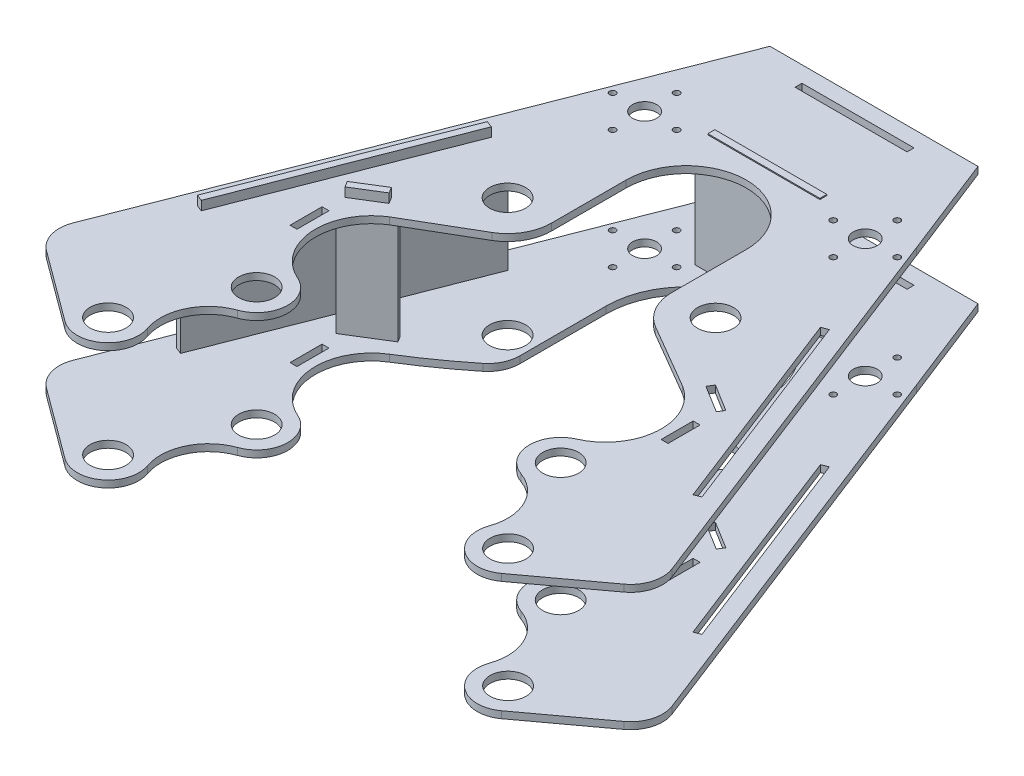
from build123d import *

# Parameters (mm, degrees)
CROQUIS13_R                   = 14.2875
CROQUIS13_R_2                 = 9.525
CROQUIS13_R_3                 = 2.4892
SALIENTE_EXTRUIR3_DEPTH       = 5.5
CROQUIS15_R                   = 14.2875
CROQUIS15_R_2                 = 2.4892
CROQUIS15_R_3                 = 9.525
SALIENTE_EXTRUIR4_DEPTH       = 5.5
REDONDEO3_R                   = 25.4
CORTAR_EXTRUIR5_DEPTH         = 415.249230424
CORTAR_EXTRUIR5_DEPTH_BACK    = 415.249230424
SALIENTE_EXTRUIR5_DEPTH       = 101.6
SALIENTE_EXTRUIR5_DEPTH_BACK  = 12.7
CROQUIS18_W                   = 5.5
CROQUIS18_H                   = 88.9
SALIENTE_EXTRUIR7_DEPTH       = 12.7
CROQUIS19_W                   = 5.5
CROQUIS19_H                   = 88.9
SALIENTE_EXTRUIR8_DEPTH       = 10.16
CORTAR_EXTRUIR7_DEPTH         = 416.949065279
CORTAR_EXTRUIR7_DEPTH_BACK    = 416.949065279
CROQUIS26_W                   = 88.9
CROQUIS26_H                   = 5.5
SALIENTE_EXTRUIR12_DEPTH      = 6.35
SALIENTE_EXTRUIR12_DEPTH_BACK = 101.6
CROQUIS27_W                   = 88.9
CROQUIS27_H                   = 5.5
CROQUIS28_W                   = 5.5
CROQUIS28_H                   = 88.9
SALIENTE_EXTRUIR13_DEPTH      = 10.16
CROQUIS29_W                   = 5.5
CROQUIS29_H                   = 88.9
SALIENTE_EXTRUIR14_DEPTH      = 10.16
CORTAR_EXTRUIR8_DEPTH         = 416.949065279
CORTAR_EXTRUIR8_DEPTH_BACK    = 416.949065279
CROQUIS41_W                   = 5.5
CROQUIS41_H                   = 25.4
SALIENTE_EXTRUIR15_DEPTH      = 12.7
SALIENTE_EXTRUIR15_DEPTH_BACK = 101.6
CROQUIS43_W                   = 5.5
CROQUIS43_H                   = 88.9
SALIENTE_EXTRUIR16_DEPTH      = 5.08
CROQUIS44_W                   = 5.5
CROQUIS44_H                   = 88.9
SALIENTE_EXTRUIR17_DEPTH      = 5.08


with BuildPart() as part:
    # Croquis13 → Saliente-Extruir3 (new body)
    with BuildSketch(Plane(origin=(0, 184.15, 0), x_dir=(1, 0, 0), z_dir=(0, 1, 0))):
        with BuildLine():
            Line((-47.753927487, -59.228856987), (-47.753927487, 0))
            ThreePointArc((-47.753927487, 0), (0, 47.753927487), (47.753927487, 0))
            Line((47.753927487, 0), (47.753927487, -59.228856987))
            ThreePointArc((47.753927487, -59.228856987), (52.378956655, -76.563066106), (65.024543628, -89.289213626))
            Line((65.024543628, -89.289213626), (116.36828917, -119.223075799))
            ThreePointArc((116.36828917, -119.223075799), (137.206577277, -160.143664069), (110.726633838, -197.660878664))
            ThreePointArc((110.726633838, -197.660878664), (95.963127804, -221.189322585), (112.411016209, -243.572703715))
            ThreePointArc((112.411016209, -243.572703715), (134.055970647, -263.012251323), (135.671142092, -292.060337061))
            ThreePointArc((135.671142092, -292.060337061), (144.229828611, -319.793855242), (173.253939317, -319.805828223))
            Line((173.253939317, -319.805828223), (229.133939317, -278.62361791))
            ThreePointArc((229.133939317, -278.62361791), (238.460514821, -265.248601277), (237.73344874, -248.959112167))
            Line((237.73344874, -248.959112167), (114.087344245, 68.540887833))
            Line((114.087344245, 68.540887833), (82.55, 149.070777022))
            Line((82.55, 149.070777022), (-82.55, 149.070777022))
            Line((-82.55, 149.070777022), (-114.087344245, 68.540887833))
            Line((-114.087344245, 68.540887833), (-237.73344874, -248.959112167))
            ThreePointArc((-237.73344874, -248.959112167), (-238.460514821, -265.248601277), (-229.133939317, -278.62361791))
            Line((-229.133939317, -278.62361791), (-173.253939317, -319.805828223))
            ThreePointArc((-173.253939317, -319.805828223), (-144.229828611, -319.793855242), (-135.671142092, -292.060337061))
            ThreePointArc((-135.671142092, -292.060337061), (-134.055970647, -263.012251323), (-112.411016209, -243.572703715))
            ThreePointArc((-112.411016209, -243.572703715), (-95.963127804, -221.189322585), (-110.726633838, -197.660878664))
            ThreePointArc((-110.726633838, -197.660878664), (-137.206577277, -160.143664069), (-116.36828917, -119.223075799))
            Line((-116.36828917, -119.223075799), (-65.024543628, -89.289213626))
            ThreePointArc((-65.024543628, -89.289213626), (-52.378956655, -76.563066106), (-47.753927487, -59.228856987))
        make_face()
        with Locations(Location((-120.65, -220.283627108, 0), (0, 0, 270))):
            Circle(CROQUIS13_R, mode=Mode.SUBTRACT)
        with Locations(Location((-82.55, -59.228856987, 0), (0, 0, 270))):
            Circle(CROQUIS13_R, mode=Mode.SUBTRACT)
        with Locations(Location((-87.546146377, 54.556438764, 0), (0, 0, 270))):
            Circle(CROQUIS13_R_2, mode=Mode.SUBTRACT)
        with Locations(Location((-87.546146377, 79.956438764, 0), (0, 0, 270))):
            Circle(CROQUIS13_R_3, mode=Mode.SUBTRACT)
        with Locations(Location((-112.946146377, 54.556438764, 0), (0, 0, 270))):
            Circle(CROQUIS13_R_3, mode=Mode.SUBTRACT)
        with Locations(Location((-62.146146377, 54.556438764, 0), (0, 0, 270))):
            Circle(CROQUIS13_R_3, mode=Mode.SUBTRACT)
        with Locations(Location((-87.546146377, 29.156438764, 0), (0, 0, 270))):
            Circle(CROQUIS13_R_3, mode=Mode.SUBTRACT)
        with Locations(Location((87.546146377, 29.156438764, 0), (0, 0, 270))):
            Circle(CROQUIS13_R_3, mode=Mode.SUBTRACT)
        with Locations(Location((62.146146377, 54.556438764, 0), (0, 0, 270))):
            Circle(CROQUIS13_R_3, mode=Mode.SUBTRACT)
        with Locations(Location((112.946146377, 54.556438764, 0), (0, 0, 270))):
            Circle(CROQUIS13_R_3, mode=Mode.SUBTRACT)
        with Locations(Location((87.546146377, 79.956438764, 0), (0, 0, 270))):
            Circle(CROQUIS13_R_3, mode=Mode.SUBTRACT)
        with Locations(Location((87.546146377, 54.556438764, 0), (0, 0, 270))):
            Circle(CROQUIS13_R_2, mode=Mode.SUBTRACT)
        with Locations(Location((82.55, -59.228856987, 0), (0, 0, 270))):
            Circle(CROQUIS13_R, mode=Mode.SUBTRACT)
        with Locations(Location((-158.75, -300.125482684, 0), (0, 0, 270))):
            Circle(CROQUIS13_R, mode=Mode.SUBTRACT)
        with Locations(Location((120.65, -220.283627108, 0), (0, 0, 270))):
            Circle(CROQUIS13_R, mode=Mode.SUBTRACT)
        with Locations(Location((158.75, -300.125482684, 0), (0, 0, 270))):
            Circle(CROQUIS13_R, mode=Mode.SUBTRACT)
    extrude(amount=SALIENTE_EXTRUIR3_DEPTH)


with BuildPart() as body_2:
    # Croquis15 → Saliente-Extruir4 (new body)
    with BuildSketch(Plane(origin=(0, 95.25, 0), x_dir=(1, 0, 0), z_dir=(0, 1, 0))):
        with BuildLine():
            Line((-63.457595278, 0), (-63.457595278, -80.587266071))
            ThreePointArc((-63.457595278, -80.587266071), (-89.200379782, -100.88100588), (-116.36828917, -119.223075799))
            ThreePointArc((-116.36828917, -119.223075799), (-137.206577277, -160.143664069), (-110.726633838, -197.660878664))
            ThreePointArc((-110.726633838, -197.660878664), (-95.963127804, -221.189322585), (-112.411016209, -243.572703715))
            ThreePointArc((-112.411016209, -243.572703715), (-134.055970647, -263.012251323), (-135.671142092, -292.060337061))
            ThreePointArc((-135.671142092, -292.060337061), (-144.229828611, -319.793855242), (-173.253939317, -319.805828223))
            Line((-173.253939317, -319.805828223), (-229.133939317, -278.62361791))
            ThreePointArc((-229.133939317, -278.62361791), (-238.460514821, -265.248601277), (-237.73344874, -248.959112167))
            Line((-237.73344874, -248.959112167), (-114.087344245, 68.540887833))
            Line((-114.087344245, 68.540887833), (-82.55, 149.070777022))
            Line((-82.55, 149.070777022), (82.55, 149.070777022))
            Line((82.55, 149.070777022), (114.087344245, 68.540887833))
            Line((114.087344245, 68.540887833), (237.73344874, -248.959112167))
            ThreePointArc((237.73344874, -248.959112167), (238.460514821, -265.248601277), (229.133939317, -278.62361791))
            Line((229.133939317, -278.62361791), (173.253939317, -319.805828223))
            ThreePointArc((173.253939317, -319.805828223), (144.229828611, -319.793855242), (135.671142092, -292.060337061))
            ThreePointArc((135.671142092, -292.060337061), (134.055970647, -263.012251323), (112.411016209, -243.572703715))
            ThreePointArc((112.411016209, -243.572703715), (95.963127804, -221.189322585), (110.726633838, -197.660878664))
            ThreePointArc((110.726633838, -197.660878664), (137.206577277, -160.143664069), (116.36828917, -119.223075799))
            ThreePointArc((116.36828917, -119.223075799), (89.200379782, -100.88100588), (63.457595278, -80.587266071))
            Line((63.457595278, -80.587266071), (63.457595278, 0))
            ThreePointArc((63.457595278, 0), (0, 63.457595278), (-63.457595278, 0))
        make_face()
        with Locations(Location((-120.65, -220.283627108, 0), (0, 0, 270))):
            Circle(CROQUIS15_R, mode=Mode.SUBTRACT)
        with Locations(Location((-158.75, -300.125482684, 0), (0, 0, 270))):
            Circle(CROQUIS15_R, mode=Mode.SUBTRACT)
        with Locations(Location((-82.55, -59.228856987, 0), (0, 0, 270))):
            Circle(CROQUIS15_R, mode=Mode.SUBTRACT)
        with Locations(Location((-112.946146377, 54.556438764, 0), (0, 0, 270))):
            Circle(CROQUIS15_R_2, mode=Mode.SUBTRACT)
        with Locations(Location((-62.146146377, 54.556438764, 0), (0, 0, 270))):
            Circle(CROQUIS15_R_2, mode=Mode.SUBTRACT)
        with Locations(Location((-87.546146377, 29.156438764, 0), (0, 0, 270))):
            Circle(CROQUIS15_R_2, mode=Mode.SUBTRACT)
        with Locations(Location((-87.546146377, 54.556438764, 0), (0, 0, 270))):
            Circle(CROQUIS15_R_3, mode=Mode.SUBTRACT)
        with Locations(Location((-87.546146377, 79.956438764, 0), (0, 0, 270))):
            Circle(CROQUIS15_R_2, mode=Mode.SUBTRACT)
        with Locations(Location((87.546146377, 79.956438764, 0), (0, 0, 270))):
            Circle(CROQUIS15_R_2, mode=Mode.SUBTRACT)
        with Locations(Location((87.546146377, 54.556438764, 0), (0, 0, 270))):
            Circle(CROQUIS15_R_3, mode=Mode.SUBTRACT)
        with Locations(Location((87.546146377, 29.156438764, 0), (0, 0, 270))):
            Circle(CROQUIS15_R_2, mode=Mode.SUBTRACT)
        with Locations(Location((62.146146377, 54.556438764, 0), (0, 0, 270))):
            Circle(CROQUIS15_R_2, mode=Mode.SUBTRACT)
        with Locations(Location((112.946146377, 54.556438764, 0), (0, 0, 270))):
            Circle(CROQUIS15_R_2, mode=Mode.SUBTRACT)
        with Locations(Location((82.55, -59.228856987, 0), (0, 0, 270))):
            Circle(CROQUIS15_R, mode=Mode.SUBTRACT)
        with Locations(Location((158.75, -300.125482684, 0), (0, 0, 270))):
            Circle(CROQUIS15_R, mode=Mode.SUBTRACT)
        with Locations(Location((120.65, -220.283627108, 0), (0, 0, 270))):
            Circle(CROQUIS15_R, mode=Mode.SUBTRACT)
    extrude(amount=-SALIENTE_EXTRUIR4_DEPTH)

    # Redondeo3
    redondeo3_edges = [body_2.edges().sort_by_distance(p)[0] for p in [
        (63.457595278, 92.5, 80.587266071),
        (-63.457595278, 92.5, 80.587266071),
    ]]
    fillet(redondeo3_edges, radius=REDONDEO3_R)


with BuildPart() as cortar_extruir5_tool:
    # Croquis16 → Cortar-Extruir5 (new, two sides: drawn at the far end of the back side and taken through both)
    with BuildSketch(Plane(origin=(0, 184.15, 0), x_dir=(1, 0, 0), z_dir=(0, 1, 0)).offset(-CORTAR_EXTRUIR5_DEPTH_BACK)):
        Polygon((130.622568598, -24.071473208), (135.747645569, -22.075580916), (200.269400026, -187.755341906), (195.144323055, -189.751234198), align=None)
        Polygon((-195.144323055, -189.751234198), (-200.269400026, -187.755341906), (-135.747645569, -22.075580916), (-130.622568598, -24.071473208), align=None)
    extrude(amount=CORTAR_EXTRUIR5_DEPTH + CORTAR_EXTRUIR5_DEPTH_BACK)


with BuildPart() as part_1:
    add(part.part)

    # Cortar-Extruir5: cut by cortar_extruir5_tool
    add(cortar_extruir5_tool.part, mode=Mode.SUBTRACT)


with BuildPart() as body_2_1:
    add(body_2.part)

    # Cortar-Extruir5: cut by cortar_extruir5_tool
    add(cortar_extruir5_tool.part, mode=Mode.SUBTRACT)


with BuildPart() as body_3:
    # Croquis17 → Saliente-Extruir5 (new, two sides: drawn at the far end of the back side and taken through both)
    with BuildSketch(Plane(origin=(0, 95.25, 0), x_dir=(1, 0, 0), z_dir=(0, 1, 0)).offset(-SALIENTE_EXTRUIR5_DEPTH_BACK)):
        Polygon((-135.747645569, -22.075580916), (-130.622568598, -24.071473208), (-195.144323055, -189.751234198), (-200.269400026, -187.755341906), align=None)
    extrude(amount=SALIENTE_EXTRUIR5_DEPTH + SALIENTE_EXTRUIR5_DEPTH_BACK)

    # Croquis18 → Saliente-Extruir7 (add)
    with BuildSketch(Plane(origin=(-89.863102773, 0, 230.751589361), x_dir=(0.9318321765481152, 0, 0.3628895076322852), z_dir=(-0.3628895076322852, 0, 0.9318321765481152))):
        with Locations((-115.733027342, 139.7)):
            Rectangle(CROQUIS18_W, CROQUIS18_H)
    extrude(amount=SALIENTE_EXTRUIR7_DEPTH)

    # Croquis19 → Saliente-Extruir8 (add)
    with BuildSketch(Plane(origin=(-25.341348316, 0, 65.071828371), x_dir=(-0.9318321765481152, 0, -0.3628895076322852), z_dir=(0.3628895076322852, 0, -0.9318321765481152))):
        with Locations((115.733027342, 139.7)):
            Rectangle(CROQUIS19_W, CROQUIS19_H)
    extrude(amount=SALIENTE_EXTRUIR8_DEPTH)


with BuildPart() as cortar_extruir7_tool:
    # Croquis26 → Cortar-Extruir7 (new, two sides: drawn at the far end of the back side and taken through both)
    with BuildSketch(Plane(origin=(0, 184.15, 0), x_dir=(1, 0, 0), z_dir=(0, 1, 0)).offset(-CORTAR_EXTRUIR7_DEPTH_BACK)):
        with Locations((-1.821146377, 66.25)):
            Rectangle(CROQUIS26_W, CROQUIS26_H)
        with Locations((0, 133.620777022)):
            Rectangle(CROQUIS26_W, CROQUIS26_H)
    extrude(amount=CORTAR_EXTRUIR7_DEPTH + CORTAR_EXTRUIR7_DEPTH_BACK)


with BuildPart() as part_2:
    add(part_1.part)

    # Cortar-Extruir7: cut by cortar_extruir7_tool
    add(cortar_extruir7_tool.part, mode=Mode.SUBTRACT)


with BuildPart() as body_2_2:
    add(body_2_1.part)

    # Cortar-Extruir7: cut by cortar_extruir7_tool
    add(cortar_extruir7_tool.part, mode=Mode.SUBTRACT)


with BuildPart() as body_4:
    # Croquis27 → Saliente-Extruir12 (new, two sides: drawn at the far end of the back side and taken through both)
    with BuildSketch(Plane(origin=(0, 184.15, 0), x_dir=(1, 0, 0), z_dir=(0, 1, 0)).offset(-SALIENTE_EXTRUIR12_DEPTH_BACK)):
        with Locations((-1.821146377, 66.25)):
            Rectangle(CROQUIS27_W, CROQUIS27_H)
    extrude(amount=SALIENTE_EXTRUIR12_DEPTH + SALIENTE_EXTRUIR12_DEPTH_BACK)

    # Croquis28 → Saliente-Extruir13 (add)
    with BuildSketch(Plane.ZY.offset(46.271146377)):
        with Locations((-66.25, 139.7)):
            Rectangle(CROQUIS28_W, CROQUIS28_H)
    extrude(amount=SALIENTE_EXTRUIR13_DEPTH)

    # Croquis29 → Saliente-Extruir14 (add)
    with BuildSketch(Plane(origin=(42.628853623, 0, 0), x_dir=(0, 0, -1), z_dir=(1, 0, 0))):
        with Locations((66.25, 139.7)):
            Rectangle(CROQUIS29_W, CROQUIS29_H)
    extrude(amount=SALIENTE_EXTRUIR14_DEPTH)


with BuildPart() as cortar_extruir8_tool:
    # Croquis41 → Cortar-Extruir8 (new, two sides: drawn at the far end of the back side and taken through both)
    with BuildSketch(Plane(origin=(0, 184.15, 0), x_dir=(1, 0, 0), z_dir=(0, 1, 0)).offset(-CORTAR_EXTRUIR8_DEPTH_BACK)):
        Polygon((128.637882721, -105.414102577), (125.741915568, -110.0899313), (147.335742763, -123.464034152), (150.231709916, -118.788205429), align=None)
        Polygon((-150.231709916, -118.788205429), (-147.335742763, -123.464034152), (-125.741915568, -110.0899313), (-128.637882721, -105.414102577), align=None)
        with Locations((147.271108258, -151.703627108)):
            Rectangle(CROQUIS41_W, CROQUIS41_H)
        with Locations((-147.271108258, -151.703627108)):
            Rectangle(CROQUIS41_W, CROQUIS41_H)
    extrude(amount=CORTAR_EXTRUIR8_DEPTH + CORTAR_EXTRUIR8_DEPTH_BACK)


with BuildPart() as part_3:
    add(part_2.part)

    # Cortar-Extruir8: cut by cortar_extruir8_tool
    add(cortar_extruir8_tool.part, mode=Mode.SUBTRACT)


with BuildPart() as body_2_3:
    add(body_2_2.part)

    # Cortar-Extruir8: cut by cortar_extruir8_tool
    add(cortar_extruir8_tool.part, mode=Mode.SUBTRACT)


with BuildPart() as body_5:
    # Croquis42 → Saliente-Extruir15 (new, two sides: drawn at the far end of the back side and taken through both)
    with BuildSketch(Plane(origin=(0, 184.15, 0), x_dir=(1, 0, 0), z_dir=(0, 1, 0)).offset(-SALIENTE_EXTRUIR15_DEPTH_BACK)):
        Polygon((-128.637882721, -105.414102577), (-125.741915568, -110.0899313), (-147.335742763, -123.464034152), (-150.231709916, -118.788205429), align=None)
    extrude(amount=SALIENTE_EXTRUIR15_DEPTH + SALIENTE_EXTRUIR15_DEPTH_BACK)

    # Croquis43 → Saliente-Extruir16 (add)
    with BuildSketch(Plane(origin=(-140.161171115, 0, 86.808600508), x_dir=(-0.5265394823645619, 0, -0.8501506769457161), z_dir=(0.8501506769457161, 0, -0.5265394823645619))):
        with Locations((-24.634946485, 139.7)):
            Rectangle(CROQUIS43_W, CROQUIS43_H)
    extrude(amount=SALIENTE_EXTRUIR16_DEPTH)

    # Croquis44 → Saliente-Extruir17 (add)
    with BuildSketch(Plane(origin=(-161.754998309, 0, 100.18270336), x_dir=(0.5265394823645596, 0, 0.8501506769457176), z_dir=(-0.8501506769457176, 0, 0.5265394823645596))):
        with Locations((24.634946485, 139.7)):
            Rectangle(CROQUIS44_W, CROQUIS44_H)
    extrude(amount=SALIENTE_EXTRUIR17_DEPTH)


solid = Compound([body_3.part, body_4.part, part_3.part, body_2_3.part, body_5.part])
